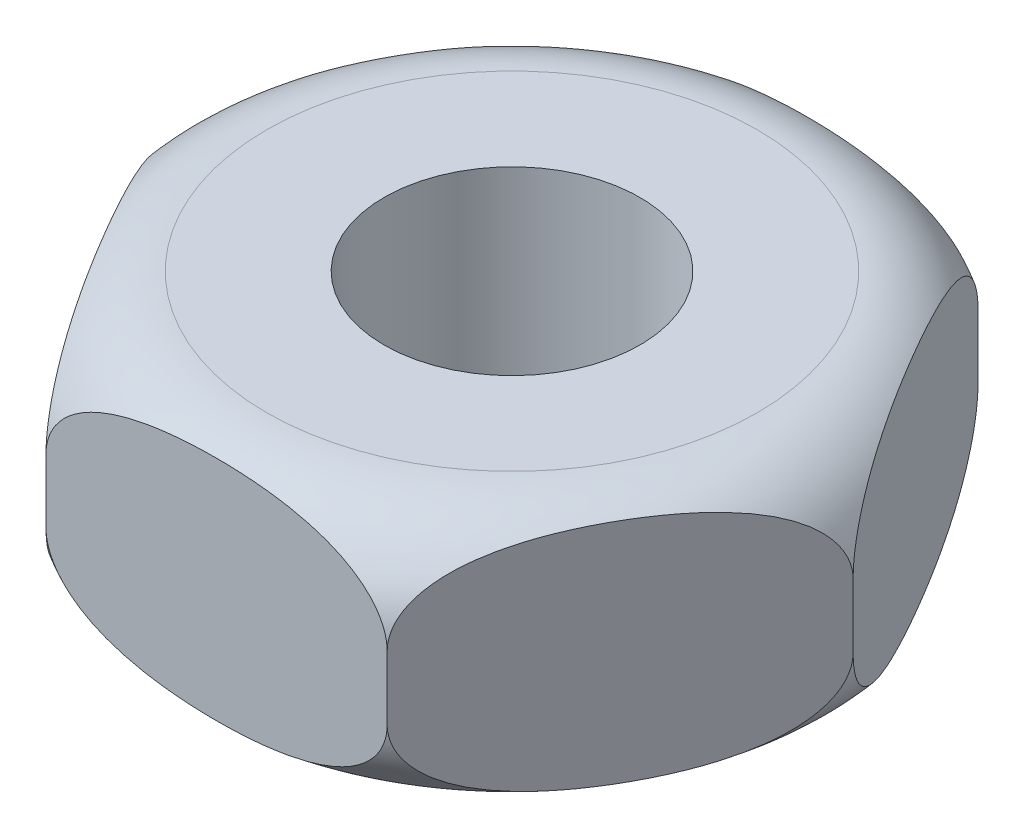
from build123d import *

# Parameters (mm, degrees)
SKETCH1_R           = 6
BOSS_EXTRUDE1_DEPTH = 6


with BuildPart() as part:
    # Sketch1 → Boss-Extrude1 (new, symmetric)
    with BuildSketch(Plane(origin=(0, 0, 0), x_dir=(1, 0, 0), z_dir=(0, 1, 0))):
        Polygon((16, 0), (8, 13.856406461), (-8, 13.856406461), (-16, 0), (-8, -13.856406461), (8, -13.856406461), align=None)
        with Locations(Location((0, 0, 0), (0, 0, 270))):
            Circle(SKETCH1_R, mode=Mode.SUBTRACT)
    extrude(amount=BOSS_EXTRUDE1_DEPTH, both=True)

    # Sketch2 → Cut-Revolve2 (revolve, cut)
    with BuildSketch(Plane.XY, mode=Mode.PRIVATE) as cut_revolve2_sk:
        with BuildLine():
            Line((11.5, 6), (16, 6))
            Line((16, 6), (16, 1.5))
            ThreePointArc((16, 1.5), (14.681980515, 4.681980515), (11.5, 6))
        make_face()
        with BuildLine():
            Line((11.5, -6), (16, -6))
            Line((16, -6), (16, -1.5))
            ThreePointArc((16, -1.5), (14.681980515, -4.681980515), (11.5, -6))
        make_face()
    revolve(cut_revolve2_sk.sketch.rotate(Axis((0, 9.943732914, 0), (0, -1, 0)), 90), axis=Axis((0, 9.943732914, 0), (0, -1, 0)), mode=Mode.SUBTRACT)


solid = part.part
